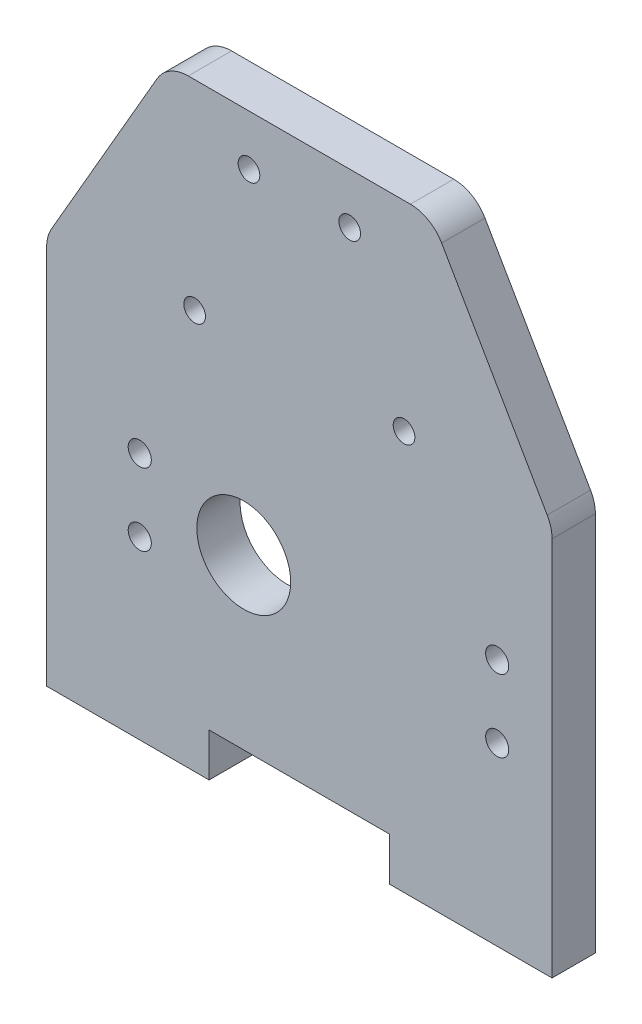
from build123d import *

# Parameters (mm, degrees)
EXTRUSION1_DEPTH = 6
HOLE1_D          = 3
HOLE2_D          = 3.2
SKETCH6_W        = 25
SKETCH6_H        = 6
EXTRUSION3_DEPTH = 10
EXTRUSION4_DEPTH = 6
FILLET1_R        = 5
SKETCH8_R        = 6.5
EXTRUSION5_DEPTH = 10


with BuildPart() as part:
    # Sketch1 → Extrusion1 (new body)
    with BuildSketch(Plane.XY):
        Polygon((35, -40), (35, 14.019237886), (20, 40), (0, 40), (0, -40), align=None)
    extrusion1 = extrude(amount=EXTRUSION1_DEPTH)

    # Mirror1: Extrusion1 across plane
    add(extrusion1.mirror(Plane(origin=(0, -8, 3), x_dir=(0, 0, 1), z_dir=(-1, 0, 0))))

    # Hole1 (through all)
    with Locations(Plane(origin=(0, 0, 0), x_dir=(-1, 0, 0), z_dir=(0, 0, -1))):
        with Locations((-6.975556847, 36), (-14.5, 15.326762343), (14.5, 15.326762343), (6.975556847, 36)):
            Hole(HOLE1_D / 2)

    # Hole2 (through all)
    with Locations(Plane.XY.offset(6)):
        with Locations((-22.1, -5.629932362), (-22.1, -15.629932362), (27.4, -15.629932362), (27.4, -5.629932362)):
            Hole(HOLE2_D / 2)

    # Sketch6 → Extrusion3 (cut)
    with BuildSketch(Plane(origin=(0, 0, 0), x_dir=(-1, 0, 0), z_dir=(0, 0, -1))):
        with Locations((0, -37)):
            Rectangle(SKETCH6_W, SKETCH6_H)
    extrude(amount=-EXTRUSION3_DEPTH, mode=Mode.SUBTRACT)

    # Sketch7 → Extrusion4 (add)
    with BuildSketch(Plane.XY.offset(6)):
        Polygon((-20, 40), (-18.267949192, 43), (18.267949192, 43), (20, 40), align=None)
    extrude(amount=-EXTRUSION4_DEPTH)

    # Fillet1
    fillet1_edges = [part.edges().sort_by_distance(p)[0] for p in [
        (-35, 14.019237886, 3),
        (-18.267949192, 43, 3),
        (18.267949192, 43, 3),
        (35, 14.019237886, 3),
    ]]
    fillet(fillet1_edges, radius=FILLET1_R)

    # Sketch8 → Extrusion5 (cut)
    with BuildSketch(Plane.XY.offset(6)):
        with Locations((-7.7, -10.629932362)):
            Circle(SKETCH8_R)
    extrude(amount=-EXTRUSION5_DEPTH, mode=Mode.SUBTRACT)


solid = part.part
